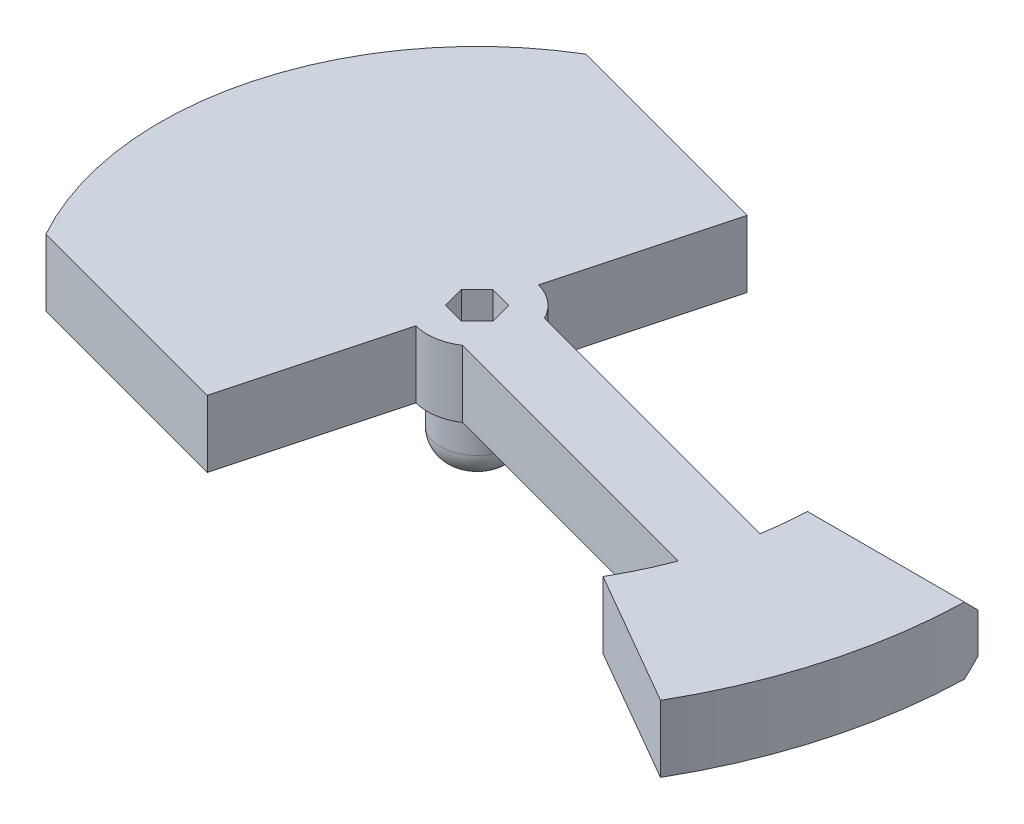
from build123d import *

# Parameters (mm, degrees)
BOSS_EXTRUDE1_DEPTH = 12.7
CUT_EXTRUDE2_DEPTH  = 15.24
CHAMFER1_SIZE       = 2.54


with BuildPart() as part:
    # Sketch1 → Boss-Extrude1 (new body)
    with BuildSketch(Plane(origin=(0, 0, 0), x_dir=(1, 0, 0), z_dir=(0, 1, 0))):
        with BuildLine():
            Line((65.393705137, 0), (95.25, 0))
            ThreePointArc((95.25, 0), (92.004434954, -24.652514046), (82.48891971, -47.625))
            Line((82.48891971, -47.625), (56.632609896, -32.696852568))
            ThreePointArc((56.632609896, -32.696852568), (59.12802761, -27.932293541), (61.223461988, -22.978780943))
            Line((61.223461988, -22.978780943), (5.214104757, -7.971118904))
            ThreePointArc((5.214104757, -7.971118904), (1.505608988, -9.405252074), (-2.465251405, -9.200443495))
            Line((-2.465251405, -9.200443495), (-10.84710618, -40.48195138))
            Line((-10.84710618, -40.48195138), (-52.758242936, -29.251896132))
            ThreePointArc((-52.758242936, -29.251896132), (-58.269475471, 15.613258896), (-31.064030575, 51.712006627))
            Line((-31.064030575, 51.712006627), (10.84710618, 40.48195138))
            Line((10.84710618, 40.48195138), (2.465251405, 9.200443495))
            ThreePointArc((2.465251405, 9.200443495), (6.006521669, 7.392382731), (8.501106629, 4.296139089))
            Line((8.501106629, 4.296139089), (64.510463861, -10.711522949))
            ThreePointArc((64.510463861, -10.711522949), (65.172520756, -5.373938012), (65.393705137, 0))
        make_face()
    extrude(amount=BOSS_EXTRUDE1_DEPTH)

    # Sketch2 → Revolve1 (revolve)
    with BuildSketch(Plane.XY, mode=Mode.PRIVATE) as revolve1_sk:
        with BuildLine():
            Line((6.985, 0), (0, 0))
            Line((0, 0), (0, -12.192))
            Line((0, -12.192), (1.905, -12.192))
            ThreePointArc((1.905, -12.192), (5.497102448, -10.704102448), (6.985, -7.112))
            Line((6.985, -7.112), (6.985, 0))
        make_face()
    revolve(revolve1_sk.sketch.rotate(Axis((0, -12.192, 0), (0, 1, 0)), 90), axis=Axis((0, -12.192, 0), (0, 1, 0)))

    # Sketch5 → Cut-Extrude2 (cut)
    with BuildSketch(Plane(origin=(0, 12.7, 0), x_dir=(1, 0, 0), z_dir=(0, 1, 0))):
        Polygon((3.007156908, 3.007156908), (-1.100695821, 4.107852729), (-4.107852729, 1.100695821), (-3.007156908, -3.007156908), (1.100695821, -4.107852729), (4.107852729, -1.100695821), align=None)
    extrude(amount=-CUT_EXTRUDE2_DEPTH, mode=Mode.SUBTRACT)

    # Chamfer1
    chamfer1_edges = [part.edges().sort_by_distance(p)[0] for p in [
        (80.321852568, 0, 0),
        (80.321852568, 12.7, 0),
    ]]
    chamfer(chamfer1_edges, length=CHAMFER1_SIZE)


solid = part.part
